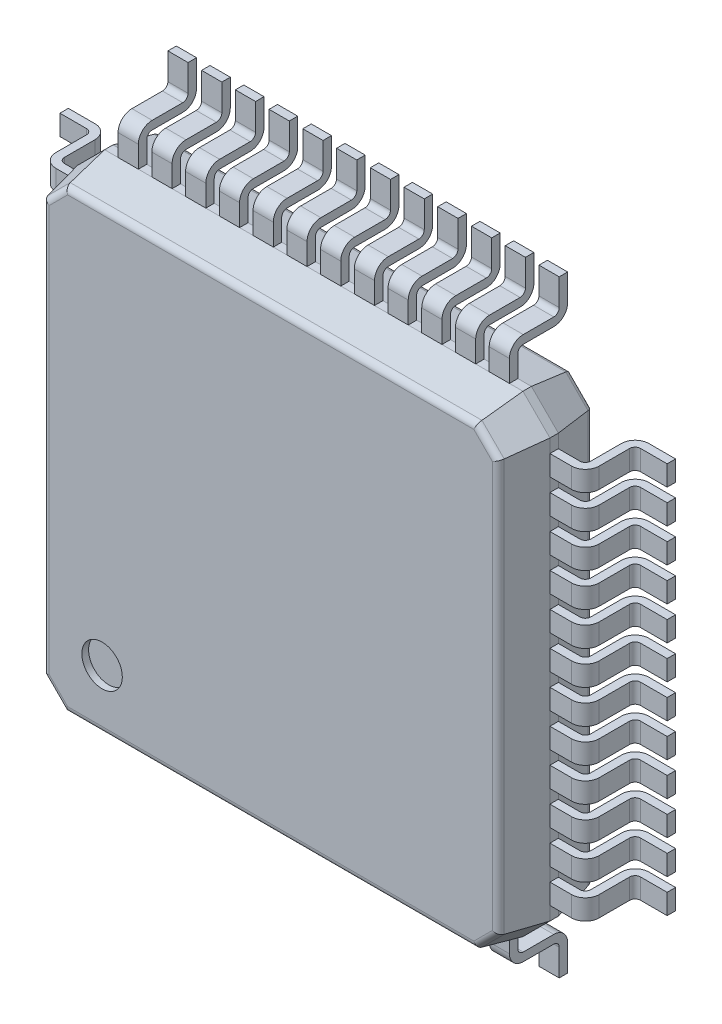
from build123d import *
from OCP.BRepFilletAPI import BRepFilletAPI_MakeChamfer

# Parameters (mm, degrees)
EXTRUDE1_DEPTH = 1.4
CHAMFER1_SIZE  = 0.6375
CHAMFER1_SIZE2 = 0.135504808
FILLET1_R      = 0.1
SKETCH2_W      = 0.3
SKETCH2_H      = 1
EXTRUDE2_DEPTH = 0.8625
EXTRUDE3_DEPTH = 8.966178507
SKETCH4_W      = 1
SKETCH4_H      = 0.3
EXTRUDE4_DEPTH = 0.8625
EXTRUDE5_DEPTH = 9.789766777
SKETCH6_R      = 0.3
EXTRUDE6_DEPTH = 0.1


with BuildPart() as part:
    # Sketch1 → Extrude1 (new body)
    with BuildSketch(Plane.XY.offset(0.1)):
        Polygon((-3.1, 3.5), (-3.5, 3.1), (-3.5, -3.1), (-3.1, -3.5), (3.1, -3.5), (3.5, -3.1), (3.5, 3.1), (3.1, 3.5), align=None)
    extrude(amount=EXTRUDE1_DEPTH)

    # Chamfer1: one chamfer whose edges measure the first distance from different faces: ONE call of the kernel's chamfer builder (chamfer() names one face for all edges)
    chamfer1_edges_1 = [part.edges().sort_by_distance(p)[0] for p in [
        (0, -3.5, 1.5),
        (0, -3.5, 0.1),
    ]]
    chamfer1_side_1 = [part.faces().sort_by_distance(p)[0] for p in [
        (0, -3.5, 0.8),
    ]]
    chamfer1_edges_2 = [part.edges().sort_by_distance(p)[0] for p in [
        (-3.3, -3.3, 0.1),
        (-3.3, -3.3, 1.5),
    ]]
    chamfer1_side_2 = [part.faces().sort_by_distance(p)[0] for p in [
        (-3.3, -3.3, 0.8),
    ]]
    chamfer1_edges_3 = [part.edges().sort_by_distance(p)[0] for p in [
        (-3.5, 0, 0.1),
        (-3.5, 0, 1.5),
    ]]
    chamfer1_side_3 = [part.faces().sort_by_distance(p)[0] for p in [
        (-3.5, 0, 0.8),
    ]]
    chamfer1_edges_4 = [part.edges().sort_by_distance(p)[0] for p in [
        (3.3, -3.3, 1.5),
        (3.3, -3.3, 0.1),
    ]]
    chamfer1_side_4 = [part.faces().sort_by_distance(p)[0] for p in [
        (3.3, -3.3, 0.8),
    ]]
    chamfer1_edges_5 = [part.edges().sort_by_distance(p)[0] for p in [
        (3.5, 0, 1.5),
        (3.5, 0, 0.1),
    ]]
    chamfer1_side_5 = [part.faces().sort_by_distance(p)[0] for p in [
        (3.5, 0, 0.8),
    ]]
    chamfer1_edges_6 = [part.edges().sort_by_distance(p)[0] for p in [
        (3.3, 3.3, 1.5),
        (3.3, 3.3, 0.1),
    ]]
    chamfer1_side_6 = [part.faces().sort_by_distance(p)[0] for p in [
        (3.3, 3.3, 0.8),
    ]]
    chamfer1_edges_7 = [part.edges().sort_by_distance(p)[0] for p in [
        (0, 3.5, 1.5),
        (0, 3.5, 0.1),
    ]]
    chamfer1_side_7 = [part.faces().sort_by_distance(p)[0] for p in [
        (0, 3.5, 0.8),
    ]]
    chamfer1_edges_8 = [part.edges().sort_by_distance(p)[0] for p in [
        (-3.3, 3.3, 1.5),
        (-3.3, 3.3, 0.1),
    ]]
    chamfer1_side_8 = [part.faces().sort_by_distance(p)[0] for p in [
        (-3.3, 3.3, 0.8),
    ]]
    chamfer1 = BRepFilletAPI_MakeChamfer(part.part.solid().wrapped)
    for e in chamfer1_edges_1:
        chamfer1.Add(CHAMFER1_SIZE, CHAMFER1_SIZE2, e.wrapped, chamfer1_side_1[0].wrapped)  # the first distance lies on this face
    for e in chamfer1_edges_2:
        chamfer1.Add(CHAMFER1_SIZE, CHAMFER1_SIZE2, e.wrapped, chamfer1_side_2[0].wrapped)  # the first distance lies on this face
    for e in chamfer1_edges_3:
        chamfer1.Add(CHAMFER1_SIZE, CHAMFER1_SIZE2, e.wrapped, chamfer1_side_3[0].wrapped)  # the first distance lies on this face
    for e in chamfer1_edges_4:
        chamfer1.Add(CHAMFER1_SIZE, CHAMFER1_SIZE2, e.wrapped, chamfer1_side_4[0].wrapped)  # the first distance lies on this face
    for e in chamfer1_edges_5:
        chamfer1.Add(CHAMFER1_SIZE, CHAMFER1_SIZE2, e.wrapped, chamfer1_side_5[0].wrapped)  # the first distance lies on this face
    for e in chamfer1_edges_6:
        chamfer1.Add(CHAMFER1_SIZE, CHAMFER1_SIZE2, e.wrapped, chamfer1_side_6[0].wrapped)  # the first distance lies on this face
    for e in chamfer1_edges_7:
        chamfer1.Add(CHAMFER1_SIZE, CHAMFER1_SIZE2, e.wrapped, chamfer1_side_7[0].wrapped)  # the first distance lies on this face
    for e in chamfer1_edges_8:
        chamfer1.Add(CHAMFER1_SIZE, CHAMFER1_SIZE2, e.wrapped, chamfer1_side_8[0].wrapped)  # the first distance lies on this face
    add(Compound.cast(chamfer1.Shape()), mode=Mode.REPLACE)

    # Fillet1
    fillet1_edges = [part.edges().sort_by_distance(p)[0] for p in [
        (-3.364495192, 0, 0.1),
        (-3.204183631, 3.204183631, 0.1),
        (0, 3.364495192, 0.1),
        (3.204183631, 3.204183631, 0.1),
        (3.364495192, 0, 0.1),
        (3.204183631, -3.204183631, 0.1),
        (0, -3.364495192, 0.1),
        (-3.204183631, -3.204183631, 0.1),
        (-3.364495192, 0, 1.5),
        (-3.204183631, -3.204183631, 1.5),
        (0, -3.364495192, 1.5),
        (3.204183631, -3.204183631, 1.5),
        (3.364495192, 0, 1.5),
        (3.204183631, 3.204183631, 1.5),
        (0, 3.364495192, 1.5),
        (-3.204183631, 3.204183631, 1.5),
    ]]
    fillet(fillet1_edges, radius=FILLET1_R)

    # Sketch2 → Extrude2 (add)
    with BuildSketch(Plane.XY):
        with Locations((2.25, -4)):
            Rectangle(SKETCH2_W, SKETCH2_H)
        with Locations((2.75, -4)):
            Rectangle(SKETCH2_W, SKETCH2_H)
        with Locations((1.75, -4)):
            Rectangle(SKETCH2_W, SKETCH2_H)
        with Locations((1.25, -4)):
            Rectangle(SKETCH2_W, SKETCH2_H)
        with Locations((0.75, -4)):
            Rectangle(SKETCH2_W, SKETCH2_H)
        with Locations((0.25, -4)):
            Rectangle(SKETCH2_W, SKETCH2_H)
        with Locations((-0.25, -4)):
            Rectangle(SKETCH2_W, SKETCH2_H)
        with Locations((-0.75, -4)):
            Rectangle(SKETCH2_W, SKETCH2_H)
        with Locations((-1.25, -4)):
            Rectangle(SKETCH2_W, SKETCH2_H)
        with Locations((-1.75, -4)):
            Rectangle(SKETCH2_W, SKETCH2_H)
        with Locations((-2.25, -4)):
            Rectangle(SKETCH2_W, SKETCH2_H)
        with Locations((-2.75, -4)):
            Rectangle(SKETCH2_W, SKETCH2_H)
    extrude2 = extrude(amount=EXTRUDE2_DEPTH)

    # Sketch3 → Extrude3 (cut, through all)
    with BuildSketch(Plane(origin=(2.9, 0, 0), x_dir=(0, 0, -1), z_dir=(1, 0, 0))):
        with BuildLine():
            Line((-0.6575, -3.9), (-0.205, -3.9))
            ThreePointArc((-0.205, -3.9), (-0.06004311, -3.96004311), (0, -4.105))
            Line((0, -4.105), (0, -3.5))
            Line((0, -3.5), (-0.7375, -3.5))
            Line((-0.7375, -3.5), (-0.7375, -3.82))
            ThreePointArc((-0.7375, -3.82), (-0.714068542, -3.876568542), (-0.6575, -3.9))
        make_face()
        with BuildLine():
            Line((-0.8625, -3.82), (-0.8625, -4.5))
            Line((-0.8625, -4.5), (-0.125, -4.5))
            Line((-0.125, -4.5), (-0.125, -4.105))
            ThreePointArc((-0.125, -4.105), (-0.148431458, -4.048431458), (-0.205, -4.025))
            Line((-0.205, -4.025), (-0.6575, -4.025))
            ThreePointArc((-0.6575, -4.025), (-0.80245689, -3.96495689), (-0.8625, -3.82))
        make_face()
    extrude3 = extrude(amount=-EXTRUDE3_DEPTH, mode=Mode.SUBTRACT)

    # Mirror1: Extrude2, Extrude3 across plane
    add(extrude2.mirror(Plane.ZX))
    add(extrude3.mirror(Plane.ZX), mode=Mode.SUBTRACT)

    # Sketch4 → Extrude4 (add)
    with BuildSketch(Plane.XY):
        with Locations((-4, -2.25)):
            Rectangle(SKETCH4_W, SKETCH4_H)
        with Locations((-4, -1.75)):
            Rectangle(SKETCH4_W, SKETCH4_H)
        with Locations((-4, -1.25)):
            Rectangle(SKETCH4_W, SKETCH4_H)
        with Locations((-4, -0.75)):
            Rectangle(SKETCH4_W, SKETCH4_H)
        with Locations((-4, -0.25)):
            Rectangle(SKETCH4_W, SKETCH4_H)
        with Locations((-4, 0.25)):
            Rectangle(SKETCH4_W, SKETCH4_H)
        with Locations((-4, 0.75)):
            Rectangle(SKETCH4_W, SKETCH4_H)
        with Locations((-4, 1.25)):
            Rectangle(SKETCH4_W, SKETCH4_H)
        with Locations((-4, 1.75)):
            Rectangle(SKETCH4_W, SKETCH4_H)
        with Locations((-4, 2.25)):
            Rectangle(SKETCH4_W, SKETCH4_H)
        with Locations((-4, -2.75)):
            Rectangle(SKETCH4_W, SKETCH4_H)
        with Locations((-4, 2.75)):
            Rectangle(SKETCH4_W, SKETCH4_H)
    extrude4 = extrude(amount=EXTRUDE4_DEPTH)

    # Sketch5 → Extrude5 (cut, through all)
    with BuildSketch(Plane.XZ.offset(2.9)):
        with BuildLine():
            Line((-3.9, 0.6575), (-3.9, 0.205))
            ThreePointArc((-3.9, 0.205), (-3.96004311, 0.06004311), (-4.105, 0))
            Line((-4.105, 0), (-3.5, 0))
            Line((-3.5, 0), (-3.5, 0.7375))
            Line((-3.5, 0.7375), (-3.82, 0.7375))
            ThreePointArc((-3.82, 0.7375), (-3.876568542, 0.714068542), (-3.9, 0.6575))
        make_face()
        with BuildLine():
            Line((-4.5, 0.125), (-4.105, 0.125))
            ThreePointArc((-4.105, 0.125), (-4.048431458, 0.148431458), (-4.025, 0.205))
            Line((-4.025, 0.205), (-4.025, 0.6575))
            ThreePointArc((-4.025, 0.6575), (-3.96495689, 0.80245689), (-3.82, 0.8625))
            Line((-3.82, 0.8625), (-4.5, 0.8625))
            Line((-4.5, 0.8625), (-4.5, 0.125))
        make_face()
    extrude5 = extrude(amount=-EXTRUDE5_DEPTH, mode=Mode.SUBTRACT)

    # Mirror2: Extrude4, Extrude5 across plane
    add(extrude4.mirror(Plane(origin=(0, 0, 0), x_dir=(0, 0, 1), z_dir=(1, 0, 0))))
    add(extrude5.mirror(Plane(origin=(0, 0, 0), x_dir=(0, 0, 1), z_dir=(1, 0, 0))), mode=Mode.SUBTRACT)

    # Sketch6 → Extrude6 (cut)
    with BuildSketch(Plane.XY.offset(1.5)):
        with Locations((-2.5, -2.5)):
            Circle(SKETCH6_R)
    extrude(amount=-EXTRUDE6_DEPTH, mode=Mode.SUBTRACT)


solid = part.part
